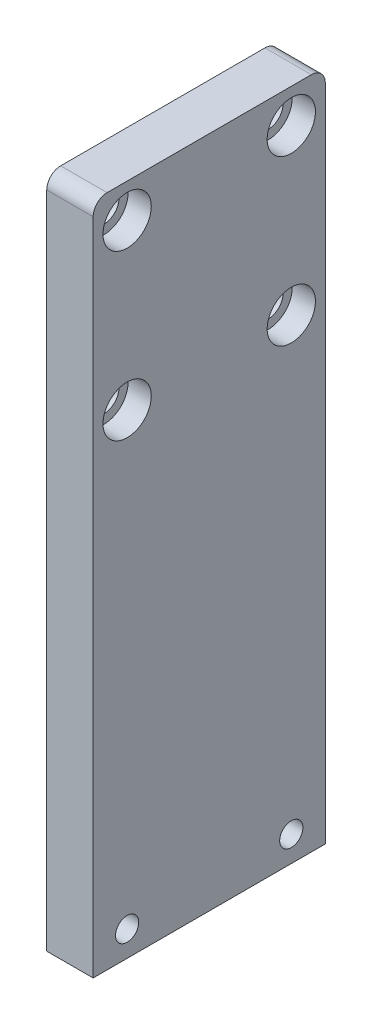
from build123d import *

# Parameters (mm, degrees)
CROQUIS1_R              = 3.25
CROQUIS1_R_2            = 2.5
SALIENTE_EXTRUIR1_DEPTH = 10
CROQUIS5_R              = 5.2
CORTAR_EXTRUIR2_DEPTH   = 5
FILLET1_R               = 3


with BuildPart() as part:
    # Croquis1 → Saliente-Extruir1 (new body)
    with BuildSketch(Plane(origin=(0, 0, 0), x_dir=(0, 0, -1), z_dir=(1, 0, 0))):
        Polygon((-25, -120), (25, -120), (25, 25), (0, 25), (-25, 25), (-25, 0), align=None)
        with Locations((-17.68, 17.68)):
            Circle(CROQUIS1_R, mode=Mode.SUBTRACT)
        with Locations(Location((17.68, 17.68, 0), (0, 0, 180))):
            Circle(CROQUIS1_R, mode=Mode.SUBTRACT)
        with Locations((17.68, -17.68)):
            Circle(CROQUIS1_R, mode=Mode.SUBTRACT)
        with Locations(Location((-17.68, -17.68, 0), (0, 0, 180))):
            Circle(CROQUIS1_R, mode=Mode.SUBTRACT)
        with Locations((-17.68, -114.5)):
            Circle(CROQUIS1_R_2, mode=Mode.SUBTRACT)
        with Locations(Location((17.68, -114.5, 0), (0, 0, 180))):
            Circle(CROQUIS1_R_2, mode=Mode.SUBTRACT)
    extrude(amount=SALIENTE_EXTRUIR1_DEPTH)

    # Croquis5 → Cortar-Extruir2 (cut)
    with BuildSketch(Plane(origin=(10, 0, 0), x_dir=(0, 0, -1), z_dir=(1, 0, 0))):
        with Locations((17.68, 17.68)):
            Circle(CROQUIS5_R)
        with Locations((-17.68, 17.68)):
            Circle(CROQUIS5_R)
        with Locations((-17.68, -17.68)):
            Circle(CROQUIS5_R)
        with Locations((17.68, -17.68)):
            Circle(CROQUIS5_R)
    extrude(amount=-CORTAR_EXTRUIR2_DEPTH, mode=Mode.SUBTRACT)

    # Fillet1
    fillet1_edges = [part.edges().sort_by_distance(p)[0] for p in [
        (5, 25, -25),
        (5, 25, 25),
    ]]
    fillet(fillet1_edges, radius=FILLET1_R)


solid = part.part
